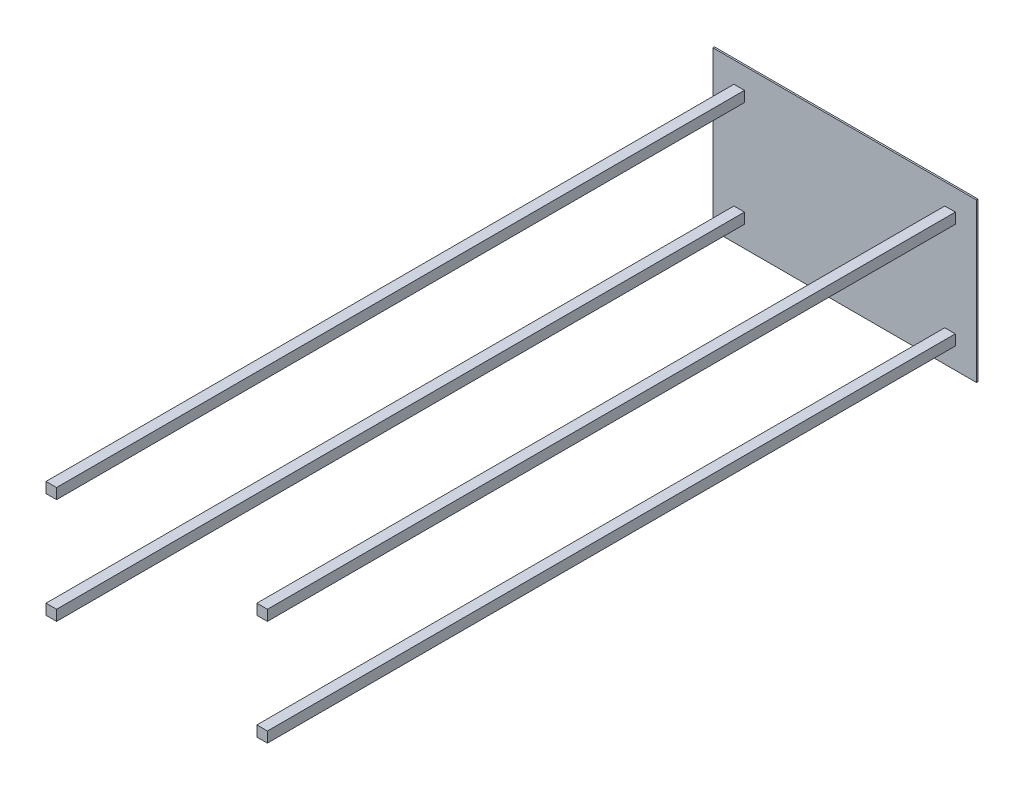
from build123d import *

# Parameters (mm, degrees)
SCHIZZO1_W                       = 500
SCHIZZO1_H                       = 300
ESTRUSIONE_ESTRUSIONE1_DEPTH     = 3
SCHIZZO2_W                       = 20
SCHIZZO2_H                       = 20
ESTRUSIONE_ESTRUSIONE2_DEPTH     = 1305
RIPETIZIONE_A_L1_COUNT           = 2
RIPETIZIONE_A_L1_PITCH           = 400
RIPETIZIONE_A_L2_COUNT           = 2
RIPETIZIONE_A_L2_PITCH           = 200
RIPETIZIONE_A_L2_COPY_1_SKETCH_W = 20
RIPETIZIONE_A_L2_COPY_1_SKETCH_H = 20
RIPETIZIONE_A_L2_COPY_1_DEPTH    = 1305


with BuildPart() as part:
    # Schizzo1 → Estrusione-Estrusione1 (new body)
    with BuildSketch(Plane.XY):
        Rectangle(SCHIZZO1_W, SCHIZZO1_H)
    extrude(amount=ESTRUSIONE_ESTRUSIONE1_DEPTH)

    # Schizzo2 → Estrusione-Estrusione2 (add)
    with BuildSketch(Plane.XY.offset(3)):
        with Locations((-200, 100)):
            Rectangle(SCHIZZO2_W, SCHIZZO2_H)
    estrusione_estrusione2 = extrude(amount=ESTRUSIONE_ESTRUSIONE2_DEPTH)

    # Ripetizione a L1: Estrusione-Estrusione2 ×2
    with Locations(*[(i * RIPETIZIONE_A_L1_PITCH, 0, 0) for i in range(1, RIPETIZIONE_A_L1_COUNT)]):
        add(estrusione_estrusione2)

    # Ripetizione a L2: Estrusione-Estrusione2 ×2
    with Locations(*[(0, -i * RIPETIZIONE_A_L2_PITCH, 0) for i in range(1, RIPETIZIONE_A_L2_COUNT)]):
        add(estrusione_estrusione2)

    # Ripetizione a L2 copy 1 sketch → Ripetizione a L2 copy 1 (add)
    with BuildSketch(Plane(origin=(400, -200, 3), x_dir=(1, 0, 0), z_dir=(0, 0, 1))):
        with Locations((-200, 100)):
            Rectangle(RIPETIZIONE_A_L2_COPY_1_SKETCH_W, RIPETIZIONE_A_L2_COPY_1_SKETCH_H)
    extrude(amount=RIPETIZIONE_A_L2_COPY_1_DEPTH)


solid = part.part
